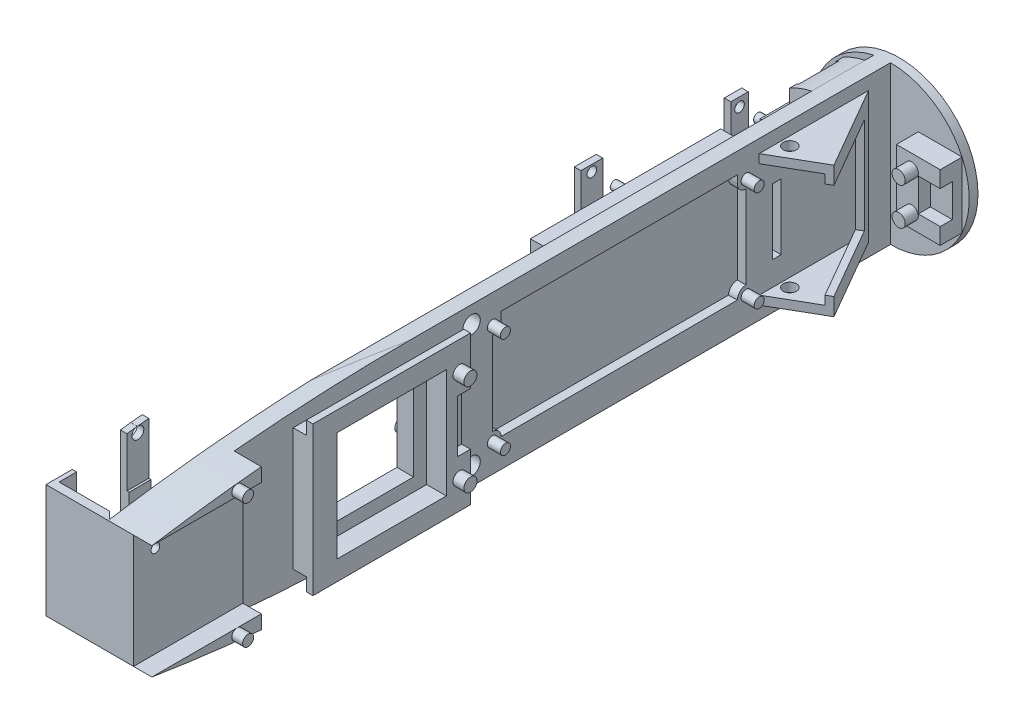
from build123d import *
from build123d.topology import SkipClean

# Parameters (mm, degrees)
SKETCH1_R                       = 18
BOSS_EXTRUDE1_DEPTH             = 2
BOSS_EXTRUDE2_DEPTH             = 150
SKETCH6_W                       = 43.5
SKETCH6_H                       = 31
SKETCH6_W_2                     = 37.5
SKETCH6_H_2                     = 25
BOSS_EXTRUDE3_DEPTH             = 5
SKETCH4_R                       = 1.15
BOSS_EXTRUDE12_DEPTH            = 3
CUT_EXTRUDE3_DEPTH              = 4
SKETCH8_W                       = 20
SKETCH8_H                       = 20
BOSS_EXTRUDE4_DEPTH             = 2
SKETCH9_W                       = 10
SKETCH9_H                       = 15
BOSS_EXTRUDE5_DEPTH             = 5
SKETCH10_W                      = 5
SKETCH10_H                      = 7.5
CUT_EXTRUDE4_DEPTH              = 2.76
SKETCH11_R                      = 1.5
BOSS_EXTRUDE6_DEPTH             = 3
CUT_EXTRUDE5_REACH              = 156.607
SKETCH12_W                      = 2
SKETCH12_H                      = 15
SKETCH13_W                      = 20
SKETCH13_H                      = 4
BOSS_EXTRUDE7_DEPTH             = 4
SKETCH14_W                      = 36
SKETCH14_H                      = 36
SKETCH14_W_2                    = 25
SKETCH14_H_2                    = 25
BOSS_EXTRUDE8_DEPTH             = 4.5
SKETCH15_W                      = 3
SKETCH15_H                      = 12
CUT_EXTRUDE6_DEPTH              = 2
BOSS_EXTRUDE9_START             = -3.8
SKETCH17_W                      = 25
SKETCH17_H                      = 26
BOSS_EXTRUDE9_DEPTH             = 5.8
CUT_EXTRUDE9_REACH              = 181.034
SKETCH20_R                      = 1
CUT_EXTRUDE10_DEPTH             = 36
SKETCH23_W                      = 14
SKETCH23_H                      = 16
SKETCH23_H_2                    = 21
BOSS_EXTRUDE10_DEPTH            = 2
SKETCH24_R                      = 1.5
BOSS_EXTRUDE11_DEPTH            = 3
CUT_EXTRUDE11_REACH             = 181.244
SKETCH25_R                      = 2
CUT_EXTRUDE12_REACH             = 181.244
SKETCH26_W                      = 19
SKETCH26_H                      = 19
SKETCH38_W                      = 25
SKETCH38_H                      = 5
BOSS_EXTRUDE22_DEPTH            = 10
CUT_EXTRUDE13_REACH             = 180.821
CUT_EXTRUDE13_DIRECTION_2_REACH = 180.821
CUT_EXTRUDE14_DEPTH             = 2
SKETCH16_R                      = 1.5
BOSS_EXTRUDE13_DEPTH            = 2.5
BOSS_EXTRUDE14_DEPTH            = 15
CUT_EXTRUDE16_DEPTH             = 13
SKETCH35_W                      = 4
SKETCH35_H                      = 4
BOSS_EXTRUDE18_DEPTH            = 6
BOSS_EXTRUDE19_DEPTH            = 2.5
BOSS_EXTRUDE19_DEPTH_BACK       = 0.1
SKETCH36_R                      = 1
SKETCH37_R                      = 1
BOSS_EXTRUDE21_DEPTH            = 2.5
SKETCH40_W                      = 14.2
SKETCH40_H                      = 26
BOSS_EXTRUDE23_DEPTH            = 2
CUT_EXTRUDE17_REACH             = 182.593
SKETCH42_W                      = 1
SKETCH42_H                      = 26
BOSS_EXTRUDE24_DEPTH            = 4
SKETCH43_W                      = 1.5
SKETCH43_H                      = 22
CUT_EXTRUDE18_DEPTH             = 19
CUT_EXTRUDE19_REACH             = 182.948
SKETCH44_R                      = 1.5
SKETCH45_R                      = 1.25
BOSS_EXTRUDE25_DEPTH            = 2.5
SKETCH46_W                      = 12.188634529
SKETCH46_H                      = 7.188634528
SKETCH46_W_2                    = 9
SKETCH46_H_2                    = 4
BOSS_EXTRUDE26_DEPTH            = 5
CUT_EXTRUDE20_REACH             = 164.78
SKETCH47_R                      = 1
SKETCH49_W                      = 4
SKETCH49_H                      = 24
SKETCH49_R                      = 1.1
BOSS_EXTRUDE27_DEPTH            = 1.5
SKETCH49_W_2                    = 5
SKETCH49_H_2                    = 31
BOSS_EXTRUDE27_2_DEPTH          = 1.5
SKETCH49_R_2                    = 1.35
BOSS_EXTRUDE27_3_DEPTH          = 1.5
SKETCH50_W                      = 5
SKETCH50_H                      = 8
BOSS_EXTRUDE28_DEPTH            = 0.5


with BuildPart() as part:
    # Sketch1 → Boss-Extrude1 (new body)
    with BuildSketch(Plane.XY):
        Circle(SKETCH1_R)
    extrude(amount=BOSS_EXTRUDE1_DEPTH)

    # Sketch3 → Boss-Extrude2 (add)
    with SkipClean():  # the faces are left unmerged after this step: merging them gives an invalid solid
        with BuildSketch(Plane.XY.offset(2)):
            with BuildLine():
                Line((0, 18), (0, -18))
                ThreePointArc((0, -18), (-1.910796855, -17.898291968), (-3.8, -17.594317264))
                Line((-3.8, -17.594317264), (-3.8, 17.594317264))
                ThreePointArc((-3.8, 17.594317264), (-1.910796855, 17.898291968), (0, 18))
            make_face()
        extrude(amount=BOSS_EXTRUDE2_DEPTH)

    # Sketch6 → Boss-Extrude3 (add)
    with SkipClean():  # the faces are left unmerged after this step: merging them gives an invalid solid
        with BuildSketch(Plane.ZY.offset(3.8)):
            with Locations((53.75, 0)):
                Rectangle(SKETCH6_W, SKETCH6_H)
            with Locations((53.75, 0)):
                Rectangle(SKETCH6_W_2, SKETCH6_H_2, mode=Mode.SUBTRACT)
        extrude(amount=BOSS_EXTRUDE3_DEPTH)

    # Sketch4 → Boss-Extrude12 (add)
    with SkipClean():  # the faces are left unmerged after this step: merging them gives an invalid solid
        with BuildSketch(Plane(origin=(0, 0, 0), x_dir=(0, 0, -1), z_dir=(1, 0, 0))):
            with Locations(Location((-93, 11.5, 0), (0, 0, 180))):
                Circle(SKETCH4_R)
            with Locations(Location((-93, -11.5, 0), (0, 0, 180))):
                Circle(SKETCH4_R)
            with Locations(Location((-35, -11.5, 0), (0, 0, 180))):
                Circle(SKETCH4_R)
            with Locations(Location((-35, 11.5, 0), (0, 0, 180))):
                Circle(SKETCH4_R)
        extrude(amount=BOSS_EXTRUDE12_DEPTH)

    # Sketch7 → Cut-Extrude3 (cut)
    with SkipClean():  # the faces are left unmerged after this step: merging them gives an invalid solid
        with BuildSketch(Plane.ZY.offset(8.8)):
            Polygon((38, -12.5), (38, -15.5), (32, -15.5), (32, -7.5), (35, -7.5), (35, -12.5), align=None)
        extrude(amount=-CUT_EXTRUDE3_DEPTH, mode=Mode.SUBTRACT)

    # Sketch8 → Boss-Extrude4 (add)
    with SkipClean():  # the faces are left unmerged after this step: merging them gives an invalid solid
        with BuildSketch(Plane.ZY.offset(3.8)):
            with Locations((12, 2)):
                Rectangle(SKETCH8_W, SKETCH8_H)
        extrude(amount=BOSS_EXTRUDE4_DEPTH)

    # Sketch9 → Boss-Extrude5 (add)
    with SkipClean():  # the faces are left unmerged after this step: merging them gives an invalid solid
        with BuildSketch(Plane.XY.offset(2)):
            with Locations((11.363068172, 0)):
                Rectangle(SKETCH9_W, SKETCH9_H)
        extrude(amount=BOSS_EXTRUDE5_DEPTH)

    # Sketch10 → Cut-Extrude4 (cut)
    with SkipClean():  # the faces are left unmerged after this step: merging them gives an invalid solid
        with BuildSketch(Plane.XY.offset(7)):
            with Locations((13.863068172, 0)):
                Rectangle(SKETCH10_W, SKETCH10_H)
        extrude(amount=-CUT_EXTRUDE4_DEPTH, mode=Mode.SUBTRACT)

    # Sketch11 → Boss-Extrude6 (add)
    with SkipClean():  # the faces are left unmerged after this step: merging them gives an invalid solid
        with BuildSketch(Plane.XY.offset(7)):
            with Locations(Location((9.863068172, 4.298304948, 0), (0, 0, 180))):
                Circle(SKETCH11_R)
            with Locations(Location((9.863068172, -4.201695052, 0), (0, 0, 180))):
                Circle(SKETCH11_R)
        extrude(amount=BOSS_EXTRUDE6_DEPTH)

    # Sketch12 → Cut-Extrude5 (cut, up to next)
    with BuildSketch(Plane.ZY.offset(3.8), mode=Mode.PRIVATE) as cut_extrude5_sk1:
        with Locations((28, 0)):
            Rectangle(SKETCH12_W, SKETCH12_H)
    cut_extrude5_tool1 = extrude(cut_extrude5_sk1.sketch, amount=-CUT_EXTRUDE5_REACH, mode=Mode.PRIVATE) & part.part
    add(cut_extrude5_tool1.solids().sort_by_distance((-3.8, 0, 28))[0], mode=Mode.SUBTRACT)

    # Sketch13 → Boss-Extrude7 (add)
    with SkipClean():  # the faces are left unmerged after this step: merging them gives an invalid solid
        with BuildSketch(Plane.ZY.offset(5.8)):
            with Locations((12, 10)):
                Rectangle(SKETCH13_W, SKETCH13_H)
        extrude(amount=BOSS_EXTRUDE7_DEPTH)

    # Sketch14 → Boss-Extrude8 (add)
    with SkipClean():  # the faces are left unmerged after this step: merging them gives an invalid solid
        with BuildSketch(Plane(origin=(0, 0, 0), x_dir=(0, 0, -1), z_dir=(1, 0, 0))):
            with Locations((-120.5, 0)):
                Rectangle(SKETCH14_W, SKETCH14_H)
            with Locations((-120.5, 0)):
                Rectangle(SKETCH14_W_2, SKETCH14_H_2, mode=Mode.SUBTRACT)
        extrude(amount=BOSS_EXTRUDE8_DEPTH)

    # Sketch15 → Cut-Extrude6 (cut)
    with SkipClean():  # the faces are left unmerged after this step: merging them gives an invalid solid
        with BuildSketch(Plane(origin=(4.5, 0, 0), x_dir=(0, 0, -1), z_dir=(1, 0, 0))):
            with Locations((-104, 0)):
                Rectangle(SKETCH15_W, SKETCH15_H)
        extrude(amount=-CUT_EXTRUDE6_DEPTH, mode=Mode.SUBTRACT)

    # Sketch17 → Boss-Extrude9 (add)
    with SkipClean():  # the faces are left unmerged after this step: merging them gives an invalid solid
        with BuildSketch(Plane(origin=(0, 0, 0), x_dir=(0, 0, -1), z_dir=(1, 0, 0)).offset(BOSS_EXTRUDE9_START)):
            with Locations((-164.5, 0)):
                Rectangle(SKETCH17_W, SKETCH17_H)
        extrude(amount=BOSS_EXTRUDE9_DEPTH)

    # Sketch20 → Cut-Extrude9 (cut, up to next)
    with BuildSketch(Plane(origin=(2, 0, 0), x_dir=(0, 0, -1), z_dir=(1, 0, 0)), mode=Mode.PRIVATE) as cut_extrude9_sk1:
        with Locations((-172, 7.9)):
            Circle(SKETCH20_R)
    cut_extrude9_tool1 = extrude(cut_extrude9_sk1.sketch, amount=-CUT_EXTRUDE9_REACH, mode=Mode.PRIVATE) & part.part
    add(cut_extrude9_tool1.solids().sort_by_distance((2, 7.9, 172))[0], mode=Mode.SUBTRACT)

    # Sketch21 → Cut-Extrude10 (cut)
    with SkipClean():  # the faces are left unmerged after this step: merging them gives an invalid solid
        with BuildSketch(Plane.XY.offset(138.5)):
            Polygon((0, 14), (3, 14), (3, 17), (5.5, 17), (5.5, 18.5), (0, 18.5), align=None)
            Polygon((0, -18.5), (0, -14), (3, -14), (3, -17), (5.5, -17), (5.5, -18.5), align=None)
        extrude(amount=-CUT_EXTRUDE10_DEPTH, mode=Mode.SUBTRACT)

    # Sketch23 → Boss-Extrude10 (add)
    with SkipClean():  # the faces are left unmerged after this step: merging them gives an invalid solid
        with BuildSketch(Plane.ZY.offset(3.8)):
            with Locations((100.5, -1)):
                Rectangle(SKETCH23_W, SKETCH23_H)
            with Locations((82.5, 0)):
                Rectangle(SKETCH23_W, SKETCH23_H_2)
        extrude(amount=BOSS_EXTRUDE10_DEPTH)

    # Sketch24 → Boss-Extrude11 (add)
    with SkipClean():  # the faces are left unmerged after this step: merging them gives an invalid solid
        with BuildSketch(Plane.ZY.offset(5.8)):
            with Locations((78, 7.5)):
                Circle(SKETCH24_R)
            with Locations((78, -7.5)):
                Circle(SKETCH24_R)
            with Locations((105, -6.5)):
                Circle(SKETCH24_R)
            with Locations((96, -6.5)):
                Circle(SKETCH24_R)
        extrude(amount=BOSS_EXTRUDE11_DEPTH)

    # Sketch25 → Cut-Extrude11 (cut, up to next)
    with BuildSketch(Plane.ZY.offset(3.8), mode=Mode.PRIVATE) as cut_extrude11_sk1:
        with Locations((97.75, 14)):
            Circle(SKETCH25_R)
    cut_extrude11_tool1 = extrude(cut_extrude11_sk1.sketch, amount=-CUT_EXTRUDE11_REACH, mode=Mode.PRIVATE) & part.part
    # Sketch25 → Cut-Extrude11 (cut, up to next)
    with BuildSketch(Plane.ZY.offset(3.8), mode=Mode.PRIVATE) as cut_extrude11_sk2:
        with Locations((97.75, -14)):
            Circle(SKETCH25_R)
    cut_extrude11_tool2 = extrude(cut_extrude11_sk2.sketch, amount=-CUT_EXTRUDE11_REACH, mode=Mode.PRIVATE) & part.part
    add(cut_extrude11_tool1.solids().sort_by_distance((-3.8, 14, 97.75))[0], mode=Mode.SUBTRACT)
    add(cut_extrude11_tool2.solids().sort_by_distance((-3.8, -14, 97.75))[0], mode=Mode.SUBTRACT)

    # Sketch26 → Cut-Extrude12 (cut, up to next)
    with BuildSketch(Plane.ZY.offset(3.8), mode=Mode.PRIVATE) as cut_extrude12_sk1:
        with Locations((120.5, 0)):
            Rectangle(SKETCH26_W, SKETCH26_H)
    cut_extrude12_tool1 = extrude(cut_extrude12_sk1.sketch, amount=-CUT_EXTRUDE12_REACH, mode=Mode.PRIVATE) & part.part
    add(cut_extrude12_tool1.solids().sort_by_distance((-3.8, 0, 120.5))[0], mode=Mode.SUBTRACT)

    # Sketch38 → Boss-Extrude22 (add)
    with SkipClean():  # the faces are left unmerged after this step: merging them gives an invalid solid
        with BuildSketch(Plane.ZY.offset(3.8)):
            with Locations((164.5, -15.5)):
                Rectangle(SKETCH38_W, SKETCH38_H)
            with Locations((164.5, 15.5)):
                Rectangle(SKETCH38_W, SKETCH38_H)
        extrude(amount=-BOSS_EXTRUDE22_DEPTH)

    # Cut-Extrude13: up to this face of the body (flat: up to its plane)
    cut_extrude13_end = Plane(part.part.faces().sort_by_distance((-3.8, 0, 53.75))[0])
    # Sketch27 → Cut-Extrude13 (cut, up to the picked face)
    with BuildSketch(Plane(origin=(0, 0, 0), x_dir=(0, 0, -1), z_dir=(1, 0, 0)), mode=Mode.PRIVATE) as cut_extrude13_sk1:
        with BuildLine():
            Line((-112, 18), (-111, 18))
            Line((-111, 18), (-111, 21))
            Line((-111, 21), (-177, 21))
            Line((-177, 21), (-177, 13))
            add(Edge.make_bspline(
                [(-112, 18), (-145.232542435, 18), (-177, 13)],
                knots=[0, 0, 0, 1, 1, 1], degree=2))
        make_face()
    cut_extrude13_tool1 = split(extrude(cut_extrude13_sk1.sketch, amount=-CUT_EXTRUDE13_REACH, mode=Mode.PRIVATE), bisect_by=cut_extrude13_end, keep=Keep.BOTH, mode=Mode.PRIVATE)
    # Sketch27 → Cut-Extrude13 (cut, up to the picked face)
    with BuildSketch(Plane(origin=(0, 0, 0), x_dir=(0, 0, -1), z_dir=(1, 0, 0)), mode=Mode.PRIVATE) as cut_extrude13_sk2:
        with BuildLine():
            Line((-112, -18), (-111, -18))
            Line((-111, -18), (-111, -21))
            Line((-111, -21), (-177, -21))
            Line((-177, -21), (-177, -13))
            add(Edge.make_bspline(
                [(-112, -18), (-145.675927837, -18), (-177, -13)],
                knots=[0, 0, 0, 1, 1, 1], degree=2))
        make_face()
    cut_extrude13_tool2 = split(extrude(cut_extrude13_sk2.sketch, amount=-CUT_EXTRUDE13_REACH, mode=Mode.PRIVATE), bisect_by=cut_extrude13_end, keep=Keep.BOTH, mode=Mode.PRIVATE)
    add(cut_extrude13_tool1.solids().sort_by(Axis((0, 18.448824, 149.918665), (-1, 0, 0)))[0], mode=Mode.SUBTRACT)
    add(cut_extrude13_tool2.solids().sort_by(Axis((0, -18.454769, 149.915113), (-1, 0, 0)))[0], mode=Mode.SUBTRACT)

    # Cut-Extrude13 direction 2: up to this face of the body (flat: up to its plane)
    cut_extrude13_direction_2_end = Plane(part.part.faces().sort_by_distance((6.2, -15.5, 164.5))[0])
    # Sketch27 → Cut-Extrude13 direction 2 (cut, up to the picked face)
    with BuildSketch(Plane(origin=(0, 0, 0), x_dir=(0, 0, -1), z_dir=(1, 0, 0)), mode=Mode.PRIVATE) as cut_extrude13_direction_2_sk1:
        with BuildLine():
            Line((-112, 18), (-111, 18))
            Line((-111, 18), (-111, 21))
            Line((-111, 21), (-177, 21))
            Line((-177, 21), (-177, 13))
            add(Edge.make_bspline(
                [(-112, 18), (-145.232542435, 18), (-177, 13)],
                knots=[0, 0, 0, 1, 1, 1], degree=2))
        make_face()
    cut_extrude13_direction_2_tool1 = split(extrude(cut_extrude13_direction_2_sk1.sketch, amount=CUT_EXTRUDE13_DIRECTION_2_REACH, mode=Mode.PRIVATE), bisect_by=cut_extrude13_direction_2_end, keep=Keep.BOTH, mode=Mode.PRIVATE)
    # Sketch27 → Cut-Extrude13 direction 2 (cut, up to the picked face)
    with BuildSketch(Plane(origin=(0, 0, 0), x_dir=(0, 0, -1), z_dir=(1, 0, 0)), mode=Mode.PRIVATE) as cut_extrude13_direction_2_sk2:
        with BuildLine():
            Line((-112, -18), (-111, -18))
            Line((-111, -18), (-111, -21))
            Line((-111, -21), (-177, -21))
            Line((-177, -21), (-177, -13))
            add(Edge.make_bspline(
                [(-112, -18), (-145.675927837, -18), (-177, -13)],
                knots=[0, 0, 0, 1, 1, 1], degree=2))
        make_face()
    cut_extrude13_direction_2_tool2 = split(extrude(cut_extrude13_direction_2_sk2.sketch, amount=CUT_EXTRUDE13_DIRECTION_2_REACH, mode=Mode.PRIVATE), bisect_by=cut_extrude13_direction_2_end, keep=Keep.BOTH, mode=Mode.PRIVATE)
    add(cut_extrude13_direction_2_tool1.solids().sort_by(Axis((0, 18.448824, 149.918665), (1, 0, 0)))[0], mode=Mode.SUBTRACT)
    add(cut_extrude13_direction_2_tool2.solids().sort_by(Axis((0, -18.454769, 149.915113), (1, 0, 0)))[0], mode=Mode.SUBTRACT)

    # Sketch28 → Cut-Extrude14 (cut)
    with SkipClean():  # the faces are left unmerged after this step: merging them gives an invalid solid
        with BuildSketch(Plane(origin=(0, 0, 0), x_dir=(0, 0, -1), z_dir=(1, 0, 0))):
            with BuildLine():
                Line((-91, 11.5), (-91, 13.3))
                Line((-91, 13.3), (-37, 13.3))
                Line((-37, 13.3), (-37, 11.5))
                ThreePointArc((-37, 11.5), (-36.414213562, 10.085786438), (-35, 9.5))
                Line((-35, 9.5), (-35, -9.5))
                ThreePointArc((-35, -9.5), (-36.414213562, -10.085786438), (-37, -11.5))
                Line((-37, -11.5), (-91, -11.5))
                ThreePointArc((-91, -11.5), (-91.585786438, -10.085786438), (-93, -9.5))
                Line((-93, -9.5), (-93, 9.5))
                ThreePointArc((-93, 9.5), (-91.585786438, 10.085786438), (-91, 11.5))
            make_face()
        extrude(amount=-CUT_EXTRUDE14_DEPTH, mode=Mode.SUBTRACT)

    # Sketch16 → Boss-Extrude13 (add)
    with SkipClean():  # the faces are left unmerged after this step: merging them gives an invalid solid
        with BuildSketch(Plane(origin=(4.5, 0, 0), x_dir=(0, 0, -1), z_dir=(1, 0, 0))):
            with Locations(Location((-105, 10.5, 0), (0, 0, 180))):
                Circle(SKETCH16_R)
            with Locations(Location((-105, -10.5, 0), (0, 0, 180))):
                Circle(SKETCH16_R)
        extrude(amount=BOSS_EXTRUDE13_DEPTH)

    # Sketch29 → Boss-Extrude14 (add, symmetric)
    with SkipClean():  # the faces are left unmerged after this step: merging them gives an invalid solid
        with BuildSketch(Plane(origin=(0, 0, 0), x_dir=(1, 0, 0), z_dir=(0, 1, 0))):
            Polygon((0, -7), (0, -32), (10.825317547, -25.75), align=None)
        extrude(amount=BOSS_EXTRUDE14_DEPTH, both=True)

    # Sketch31 → Cut-Extrude16 (cut, symmetric)
    with SkipClean():  # the faces are left unmerged after this step: merging them gives an invalid solid
        with BuildSketch(Plane(origin=(0, 0, 0), x_dir=(1, 0, 0), z_dir=(0, 1, 0))):
            Polygon((0, -10), (9.526279442, -26.5), (0, -32), align=None)
        extrude(amount=CUT_EXTRUDE16_DEPTH, both=True, mode=Mode.SUBTRACT)

    # Sketch35 → Boss-Extrude18 (add)
    with SkipClean():  # the faces are left unmerged after this step: merging them gives an invalid solid
        with BuildSketch(Plane.ZY.offset(3.8)):
            with Locations((20, -10)):
                Rectangle(SKETCH35_W, SKETCH35_H)
        extrude(amount=BOSS_EXTRUDE18_DEPTH)

    # Sketch36 → Boss-Extrude19 (add, two sides: drawn at the far end of the back side and taken through both)
    with SkipClean():  # the faces are left unmerged after this step: merging them gives an invalid solid
        with BuildSketch(Plane.ZY.offset(9.8).offset(-BOSS_EXTRUDE19_DEPTH_BACK)):
            with Locations((20, -10)):
                Circle(SKETCH36_R)
            with Locations((20, 10)):
                Circle(SKETCH36_R)
        extrude(amount=BOSS_EXTRUDE19_DEPTH + BOSS_EXTRUDE19_DEPTH_BACK)

    # Sketch37 → Boss-Extrude21 (add)
    with SkipClean():  # the faces are left unmerged after this step: merging them gives an invalid solid
        with BuildSketch(Plane.ZY.offset(8.8)):
            with Locations(Location((53.75, 14, 0), (0, 0, 180))):
                Circle(SKETCH37_R)
            with Locations(Location((53.75, -14, 0), (0, 0, 180))):
                Circle(SKETCH37_R)
        extrude(amount=BOSS_EXTRUDE21_DEPTH)

    # Sketch40 → Boss-Extrude23 (add)
    with SkipClean():  # the faces are left unmerged after this step: merging them gives an invalid solid
        with BuildSketch(Plane.XY.offset(177)):
            with Locations((-10.9, 0)):
                Rectangle(SKETCH40_W, SKETCH40_H)
        extrude(amount=-BOSS_EXTRUDE23_DEPTH)

    # Sketch41 → Cut-Extrude17 (cut, up to next)
    with BuildSketch(Plane(origin=(0, 13, 0), x_dir=(1, 0, 0), z_dir=(0, 1, 0)), mode=Mode.PRIVATE) as cut_extrude17_sk1:
        Polygon((-5.438090795, -175), (-3.8, -176.638090795), (-3.8, -175), align=None)
    cut_extrude17_tool1 = extrude(cut_extrude17_sk1.sketch, amount=-CUT_EXTRUDE17_REACH, mode=Mode.PRIVATE) & part.part
    add(cut_extrude17_tool1.solids().sort_by_distance((-4.34603, 13, 175.54603))[0], mode=Mode.SUBTRACT)

    # Sketch42 → Boss-Extrude24 (add)
    with SkipClean():  # the faces are left unmerged after this step: merging them gives an invalid solid
        with BuildSketch(Plane(origin=(0, 0, 175), x_dir=(-1, 0, 0), z_dir=(0, 0, -1))):
            with Locations((17.5, 0)):
                Rectangle(SKETCH42_W, SKETCH42_H)
        extrude(amount=BOSS_EXTRUDE24_DEPTH)

    # Sketch43 → Cut-Extrude18 (cut)
    with SkipClean():  # the faces are left unmerged after this step: merging them gives an invalid solid
        with BuildSketch(Plane(origin=(13.856406461, 0, 24), x_dir=(0.8660254037844433, 0, -0.4999999999999922), z_dir=(0.4999999999999921, 0, 0.8660254037844431))):
            with Locations((-4.25, 0)):
                Rectangle(SKETCH43_W, SKETCH43_H)
        extrude(amount=-CUT_EXTRUDE18_DEPTH, mode=Mode.SUBTRACT)

    # Cut-Extrude19: up to this face of the body (flat: up to its plane)
    cut_extrude19_end = Plane(part.part.faces().sort_by_distance((3.608439182, 15, 21.583333333))[0])
    # Sketch44 → Cut-Extrude19 (cut, up to the picked face)
    with BuildSketch(Plane.XZ.offset(15), mode=Mode.PRIVATE) as cut_extrude19_sk1:
        with Locations(Location((2, 27, 0), (0, 0, 270))):
            Circle(SKETCH44_R)
    cut_extrude19_tool1 = split(extrude(cut_extrude19_sk1.sketch, amount=-CUT_EXTRUDE19_REACH, mode=Mode.PRIVATE), bisect_by=cut_extrude19_end, keep=Keep.BOTH, mode=Mode.PRIVATE)
    add(cut_extrude19_tool1.solids().sort_by(Axis((2, -15, 27), (0, 1, 0)))[0], mode=Mode.SUBTRACT)

    # Sketch45 → Boss-Extrude25 (add)
    with SkipClean():  # the faces are left unmerged after this step: merging them gives an invalid solid
        with BuildSketch(Plane(origin=(6.2, 0, 0), x_dir=(0, 0, -1), z_dir=(1, 0, 0))):
            with Locations(Location((-157.5, 14.25, 0), (0, 0, 270))):
                Circle(SKETCH45_R)
            with Locations(Location((-157.5, -14.25, 0), (0, 0, 90))):
                Circle(SKETCH45_R)
        extrude(amount=BOSS_EXTRUDE25_DEPTH)

    # Sketch46 → Boss-Extrude26 (add)
    with SkipClean():  # the faces are left unmerged after this step: merging them gives an invalid solid
        with BuildSketch(Plane.ZY.offset(3.8)):
            with Locations((10.128848536, 14)):
                Rectangle(SKETCH46_W, SKETCH46_H)
            with Locations((10.128848536, 14)):
                Rectangle(SKETCH46_W_2, SKETCH46_H_2, mode=Mode.SUBTRACT)
        extrude(amount=BOSS_EXTRUDE26_DEPTH)

    # Sketch47 → Cut-Extrude20 (cut, up to next)
    with BuildSketch(Plane.XY.offset(16.2231658), mode=Mode.PRIVATE) as cut_extrude20_sk1:
        with Locations((-4.993528373, 14)):
            Circle(SKETCH47_R)
    cut_extrude20_tool1 = extrude(cut_extrude20_sk1.sketch, amount=-CUT_EXTRUDE20_REACH, mode=Mode.PRIVATE) & part.part
    # Sketch47 → Cut-Extrude20 (cut, up to next)
    with BuildSketch(Plane.XY.offset(16.2231658), mode=Mode.PRIVATE) as cut_extrude20_sk2:
        with BuildLine():
            Line((-3.8, 17.594317264), (-3.8, 18.155263545))
            Line((-3.8, 18.155263545), (-9.127419897, 18.155263545))
            Line((-9.127419897, 18.155263545), (-9.127419897, 15.514193696))
            add(Edge.make_bspline(
                [(-3.8, 17.594317264), (-6.595110721, 16.99063253), (-9.127419897, 15.514193696)],
                knots=[0, 0, 0, 1, 1, 1], degree=2))
        make_face()
    cut_extrude20_tool2 = extrude(cut_extrude20_sk2.sketch, amount=-CUT_EXTRUDE20_REACH, mode=Mode.PRIVATE) & part.part
    add(cut_extrude20_tool1.solids().sort_by_distance((-4.993528, 14, 16.223166))[0], mode=Mode.SUBTRACT)
    add(cut_extrude20_tool2.solids().sort_by_distance((-7.102734, 17.310027, 16.223166))[0], mode=Mode.SUBTRACT)


with BuildPart() as body_2:
    # Sketch49 → Boss-Extrude27 (new body)
    with BuildSketch(Plane.ZY.offset(18)):
        with Locations((20, 0)):
            Rectangle(SKETCH49_W, SKETCH49_H)
        with Locations((20, 10)):
            Circle(SKETCH49_R, mode=Mode.SUBTRACT)
        with Locations((20, -10)):
            Circle(SKETCH49_R, mode=Mode.SUBTRACT)
    extrude(amount=-BOSS_EXTRUDE27_DEPTH)


with BuildPart() as body_3:
    # Sketch49 → Boss-Extrude27 2 (new body)
    with BuildSketch(Plane.ZY.offset(18)):
        with Locations((53.75, 0)):
            Rectangle(SKETCH49_W_2, SKETCH49_H_2)
        with Locations((53.75, -14)):
            Circle(SKETCH49_R, mode=Mode.SUBTRACT)
        with Locations((53.75, 14)):
            Circle(SKETCH49_R, mode=Mode.SUBTRACT)
    extrude(amount=-BOSS_EXTRUDE27_2_DEPTH)


with BuildPart() as body_4:
    # Sketch49 → Boss-Extrude27 3 (new body)
    with BuildSketch(Plane.ZY.offset(18)):
        with BuildLine():
            add(Edge.make_bspline(
                [(155, 15.845332499), (157.50695604, 15.639549311), (160, 15.305769068)],
                knots=[0, 0, 0, 1, 1, 1], degree=2))
            Line((160, 15.305769068), (160, -15.325617117))
            add(Edge.make_bspline(
                [(155, -15.865710267), (157.502613733, -15.619794284), (160, -15.325617117)],
                knots=[0, 0, 0, 1, 1, 1], degree=2))
            Line((155, -15.865710267), (155, 15.845332499))
        make_face()
        with Locations((157.5, -14.25)):
            Circle(SKETCH49_R_2, mode=Mode.SUBTRACT)
        with Locations((157.5, 14.25)):
            Circle(SKETCH49_R_2, mode=Mode.SUBTRACT)
    extrude(amount=-BOSS_EXTRUDE27_3_DEPTH)

    # Sketch50 → Boss-Extrude28 (add)
    with BuildSketch(Plane(origin=(-16.5, 0, 0), x_dir=(0, 0, -1), z_dir=(1, 0, 0))):
        with Locations((-157.5, -0.010188884)):
            Rectangle(SKETCH50_W, SKETCH50_H)
    extrude(amount=BOSS_EXTRUDE28_DEPTH)


solid = Compound([part.part, body_2.part, body_3.part, body_4.part])
